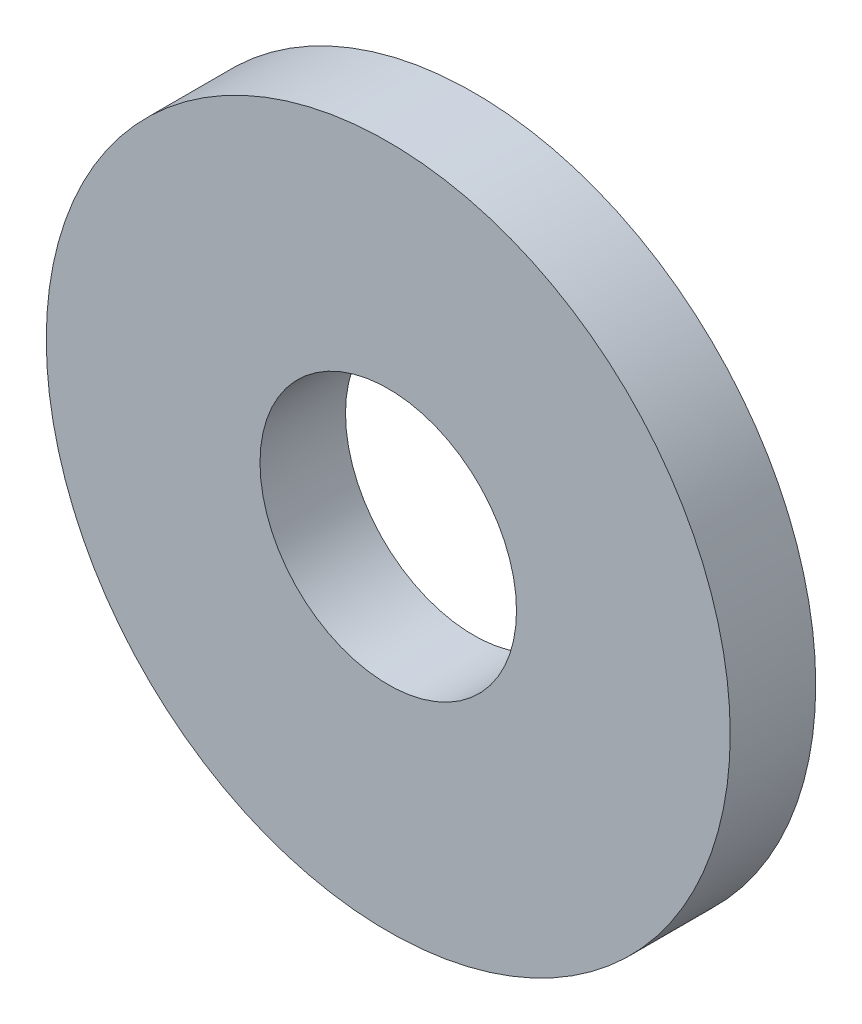
from build123d import *

# Parameters (mm, degrees)
SKETCH1_R           = 20
SKETCH1_R_2         = 7.5
BOSS_EXTRUDE1_DEPTH = 5


with BuildPart() as part:
    # Sketch1 → Boss-Extrude1 (new body)
    with BuildSketch(Plane.XY):
        Circle(SKETCH1_R)
        Circle(SKETCH1_R_2, mode=Mode.SUBTRACT)
    extrude(amount=BOSS_EXTRUDE1_DEPTH)


solid = part.part
